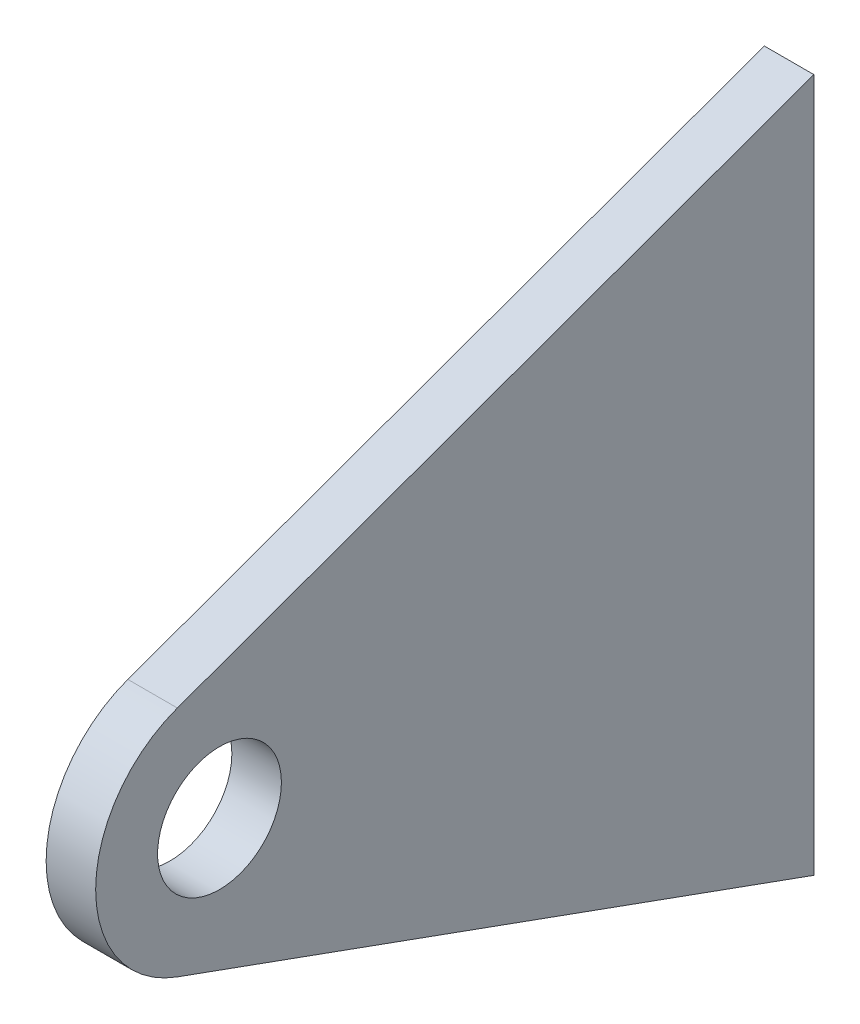
from build123d import *

# Parameters (mm, degrees)
SKETCH2_R           = 25
BOSS_EXTRUDE1_DEPTH = 10


with BuildPart() as part:
    # Sketch2 → Boss-Extrude1 (new, symmetric)
    with BuildSketch(Plane.YZ):
        with BuildLine():
            Line((0, 0), (140, 0))
            Line((140, 0), (47.017565913, 257.010246783))
            ThreePointArc((47.017565913, 257.010246783), (0, 290), (-47.017565913, 257.010246783))
            Line((-47.017565913, 257.010246783), (-140, 0))
            Line((-140, 0), (0, 0))
        make_face()
        with Locations(Location((0, 240, 0), (0, 0, 270))):
            Circle(SKETCH2_R, mode=Mode.SUBTRACT)
    extrude(amount=BOSS_EXTRUDE1_DEPTH, both=True)


solid = part.part
